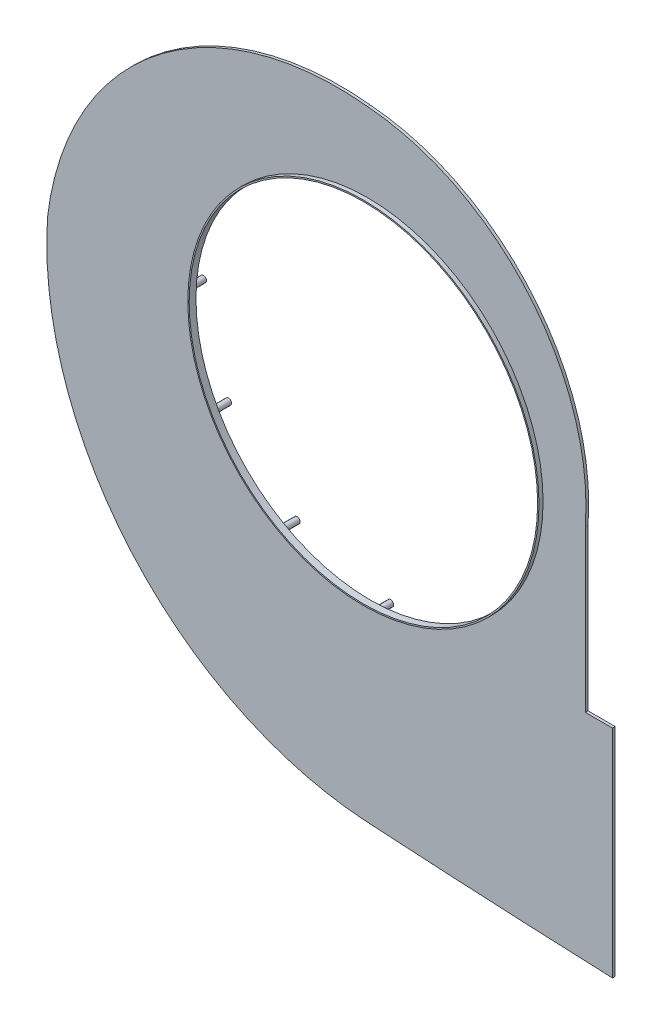
from build123d import *

# Parameters (mm, degrees)
BOSS_EXTRUDE1_DEPTH = 4
SKETCH2_R           = 256
CUT_EXTRUDE1_DEPTH  = 50
EXTRUDE_THIN1_START = -10
SKETCH3_R           = 258
SKETCH3_R_2         = 256
EXTRUDE_THIN1_DEPTH = 10
SKETCH4_R           = 4.5
BOSS_EXTRUDE2_DEPTH = 30
CIRPATTERN1_COUNT   = 12


with BuildPart() as part:
    # Sketch1 → Boss-Extrude1 (new body)
    with BuildSketch(Plane.XY):
        with BuildLine():
            Line((865.269127642, 521.057153497), (865.269127642, 757.057153497))
            ThreePointArc((865.269127642, 757.057153497), (782.812941082, 1010.7278743), (545.269127642, 1132.057153497))
            ThreePointArc((545.269127642, 1132.057153497), (233.519744905, 1040.749713195), (75.269127642, 757.057153497))
            ThreePointArc((75.269127642, 757.057153497), (198.687627947, 391.283260157), (545.269127642, 221.271697797))
            ThreePointArc((545.269127642, 221.271697797), (725.219790584, 211.189307063), (905.269127642, 203.057153497))
            Line((905.269127642, 203.057153497), (905.269127642, 521.057153497))
            Line((905.269127642, 521.057153497), (865.269127642, 521.057153497))
        make_face()
    extrude(amount=BOSS_EXTRUDE1_DEPTH)

    # Sketch2 → Cut-Extrude1 (cut)
    with BuildSketch(Plane.XY.offset(4)):
        with Locations((545.269127642, 758.057153497)):
            Circle(SKETCH2_R)
    extrude(amount=-CUT_EXTRUDE1_DEPTH, mode=Mode.SUBTRACT)

    # Sketch3 → Extrude-Thin1 (add)
    with BuildSketch(Plane(origin=(0, 0, 0), x_dir=(-1, 0, 0), z_dir=(0, 0, -1)).offset(EXTRUDE_THIN1_START)):
        with Locations((-545.269127642, 758.057153497)):
            Circle(SKETCH3_R)
        with Locations((-545.269127642, 758.057153497)):
            Circle(SKETCH3_R_2, mode=Mode.SUBTRACT)
    extrude(amount=EXTRUDE_THIN1_DEPTH)

    # Sketch4 → Boss-Extrude2 (add)
    with BuildSketch(Plane(origin=(0, 0, 0), x_dir=(-1, 0, 0), z_dir=(0, 0, -1))):
        with Locations((-545.269127642, 1033.057153497)):
            Circle(SKETCH4_R)
    boss_extrude2 = extrude(amount=BOSS_EXTRUDE2_DEPTH)

    # CirPattern1: Boss-Extrude2 ×12 about axis
    cirpattern1_axis = Axis((545.269127642, 758.057153497, 0), (0, 0, 1))
    for i in range(1, CIRPATTERN1_COUNT):
        add(boss_extrude2.rotate(cirpattern1_axis, i * 360 / CIRPATTERN1_COUNT))


solid = part.part
